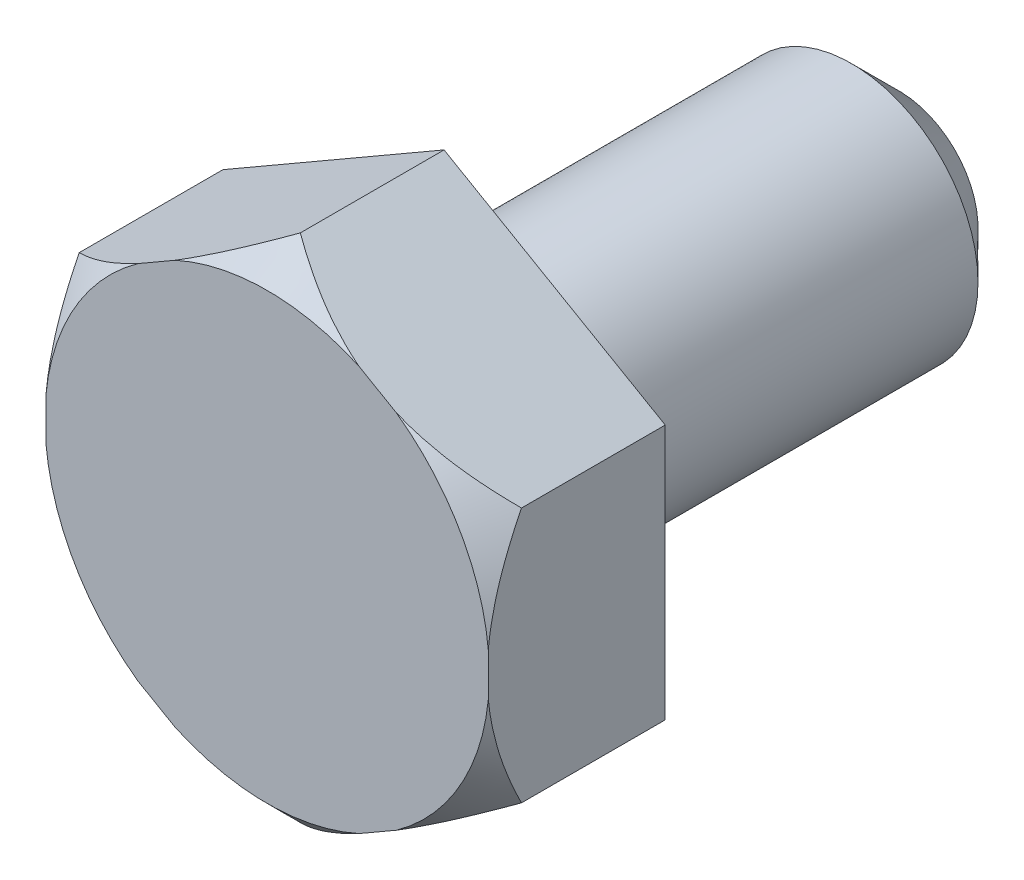
from build123d import *

# Parameters (mm, degrees)
EXTRUDE_1_DEPTH = 2.8
SKETCH_2_R      = 2
EXTRUDE_2_DEPTH = 7.2
CHAMFER_1_SIZE  = 0.75


with BuildPart() as part:
    # Эскиз1 → Вытянуть1 (new body)
    with BuildSketch(Plane.XY):
        Polygon((0, 4.041451884), (-3.5, 2.020725942), (-3.5, -2.020725942), (0, -4.041451884), (3.5, -2.020725942), (3.5, 2.020725942), align=None)
    extrude(amount=EXTRUDE_1_DEPTH)

    # Эскиз2 → Вытянуть2 (add)
    with BuildSketch(Plane(origin=(0, 0, 0), x_dir=(-1, 0, 0), z_dir=(0, 0, -1))):
        Circle(SKETCH_2_R)
    extrude(amount=EXTRUDE_2_DEPTH)

    # Эскиз15 → Вырез-Повернуть1 (revolve, cut)
    with BuildSketch(Plane(origin=(0, 0, 0), x_dir=(0, 0, -1), z_dir=(1, 0, 0))):
        Polygon((-2.8, 4.041451884), (-2.8, 3.516451884), (-2.275, 4.041451884), align=None)
    revolve(axis=Axis((0, 0, 5.265296569), (0, 0, -1)), mode=Mode.SUBTRACT)

    # Фаска1
    chamfer_1_edges = [part.edges().sort_by_distance(p)[0] for p in [
        (2, 0, -7.2),
    ]]
    chamfer(chamfer_1_edges, length=CHAMFER_1_SIZE)


solid = part.part
